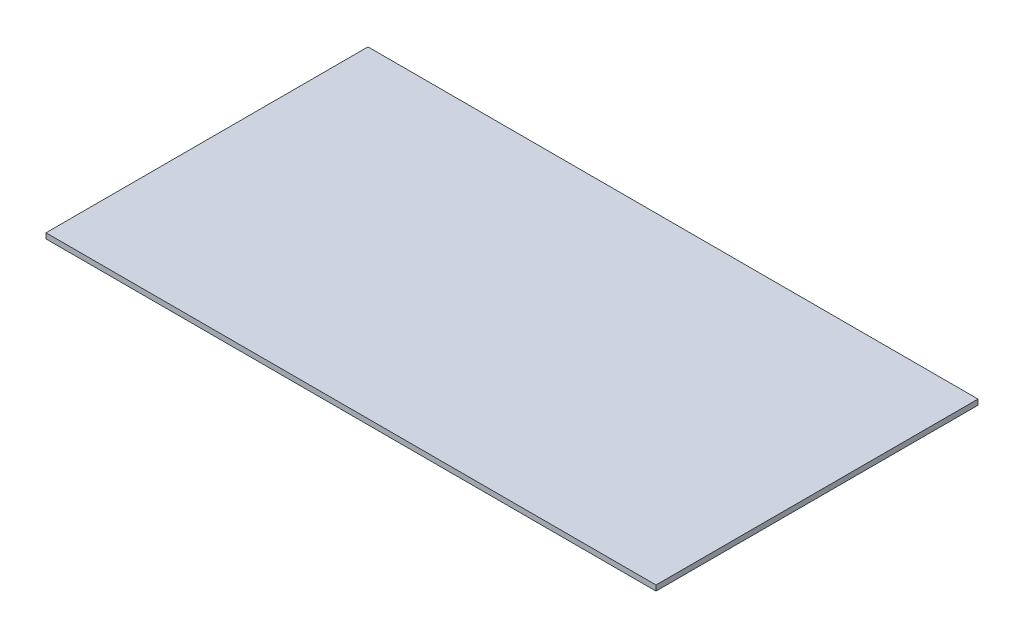
from build123d import *

# Parameters (mm, degrees)
SKETCH1_W           = 543.73
SKETCH1_H           = 4.7625
BOSS_EXTRUDE1_DEPTH = 287


with BuildPart() as part:
    # Sketch1 → Boss-Extrude1 (new body)
    with BuildSketch(Plane.XY):
        with Locations((-308.730031966, 2.060431686)):
            Rectangle(SKETCH1_W, SKETCH1_H)
    extrude(amount=BOSS_EXTRUDE1_DEPTH)


solid = part.part
